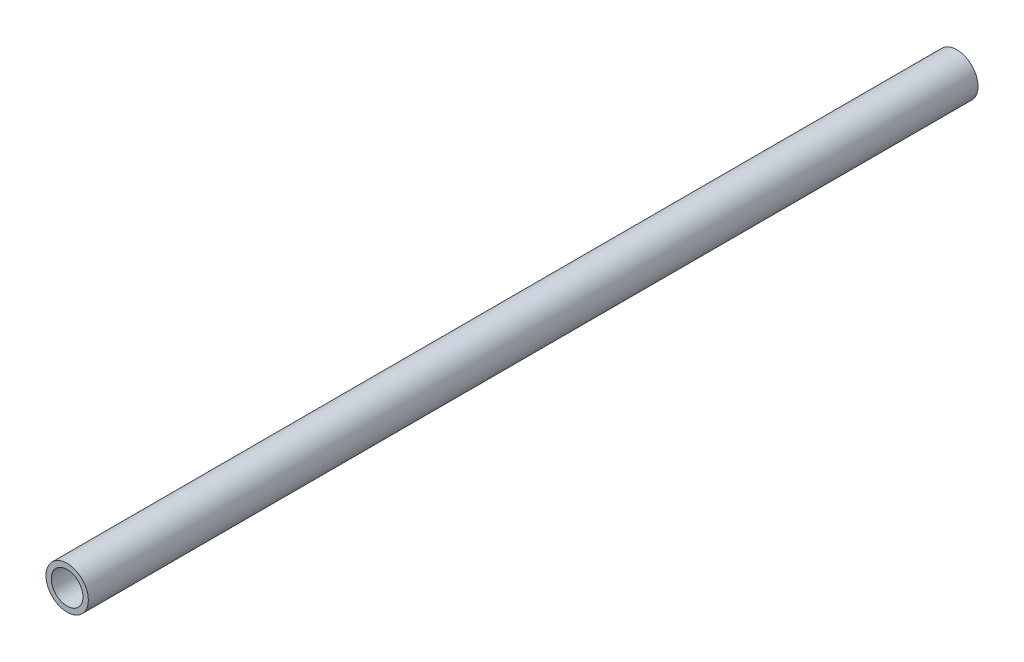
from build123d import *

# Parameters (mm, degrees)
SKETCH1_R           = 12.7
SKETCH1_R_2         = 9.525
BOSS_EXTRUDE1_DEPTH = 533.4


with BuildPart() as part:
    # Sketch1 → Boss-Extrude1 (new body)
    with BuildSketch(Plane.XY):
        Circle(SKETCH1_R)
        Circle(SKETCH1_R_2, mode=Mode.SUBTRACT)
    extrude(amount=BOSS_EXTRUDE1_DEPTH)


solid = part.part
